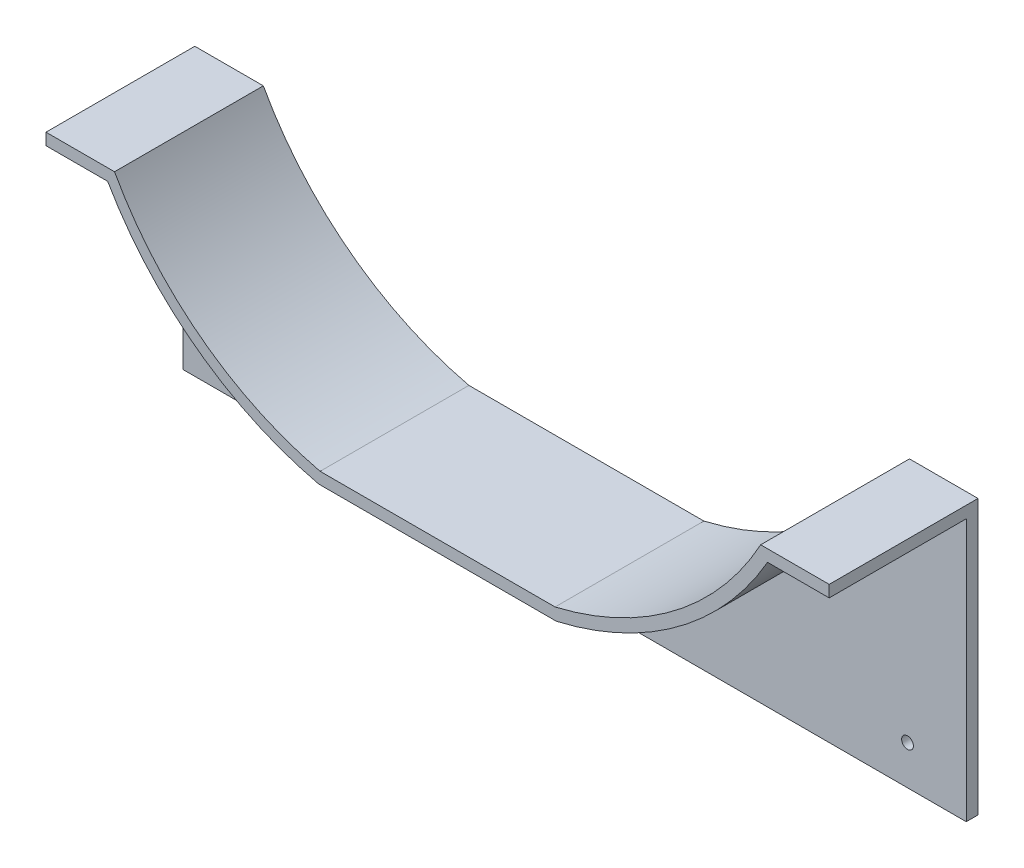
from build123d import *

# Parameters (mm, degrees)
SKETCH_1_W          = 200
SKETCH_1_H          = 30
EXTRUDE_1_DEPTH     = 3
SKETCH_2_R          = 1.5
CUT_EXTRUDE_1_DEPTH = 3
EXTRUDE_2_DEPTH     = 35


with BuildPart() as part:
    # 草图1 → 凸台-拉伸1 (new body)
    with BuildSketch(Plane.XY):
        with Locations((100, -15)):
            Rectangle(SKETCH_1_W, SKETCH_1_H)
        with BuildLine():
            Line((0, 40), (0, 0))
            Line((0, 0), (70, 0))
            ThreePointArc((70, 0), (39.497390629, 14.4184502), (17.5, 40))
            Line((17.5, 40), (0, 40))
        make_face()
        with BuildLine():
            ThreePointArc((182.5, 40), (160.502609371, 14.4184502), (130, 0))
            Line((130, 0), (200, 0))
            Line((200, 0), (200, 40))
            Line((200, 40), (182.5, 40))
        make_face()
    extrude(amount=EXTRUDE_1_DEPTH)

    # 草图2 → 切除-拉伸1 (cut)
    with BuildSketch(Plane.XY.offset(3)):
        with Locations((185, -20)):
            Circle(SKETCH_2_R)
        with Locations((100, -20)):
            Circle(SKETCH_2_R)
        with Locations((15, -20)):
            Circle(SKETCH_2_R)
    extrude(amount=-CUT_EXTRUDE_1_DEPTH, mode=Mode.SUBTRACT)

    # 草图15 → 凸台-拉伸2 (add)
    with BuildSketch(Plane.XY.offset(3)):
        with BuildLine():
            Line((69.653562136, -3), (130.346437864, -3))
            ThreePointArc((130.346437864, -3), (161.46492885, 11.388677272), (184.25647691, 37))
            Line((184.25647691, 37), (200, 37))
            Line((200, 37), (200, 40))
            Line((200, 40), (182.5, 40))
            ThreePointArc((182.5, 40), (160.502609371, 14.4184502), (130, 0))
            Line((130, 0), (70, 0))
            ThreePointArc((70, 0), (39.497390629, 14.4184502), (17.5, 40))
            Line((17.5, 40), (0, 40))
            Line((0, 40), (0, 37))
            Line((0, 37), (15.74352309, 37))
            ThreePointArc((15.74352309, 37), (38.53507115, 11.388677272), (69.653562136, -3))
        make_face()
    extrude(amount=EXTRUDE_2_DEPTH)


solid = part.part
